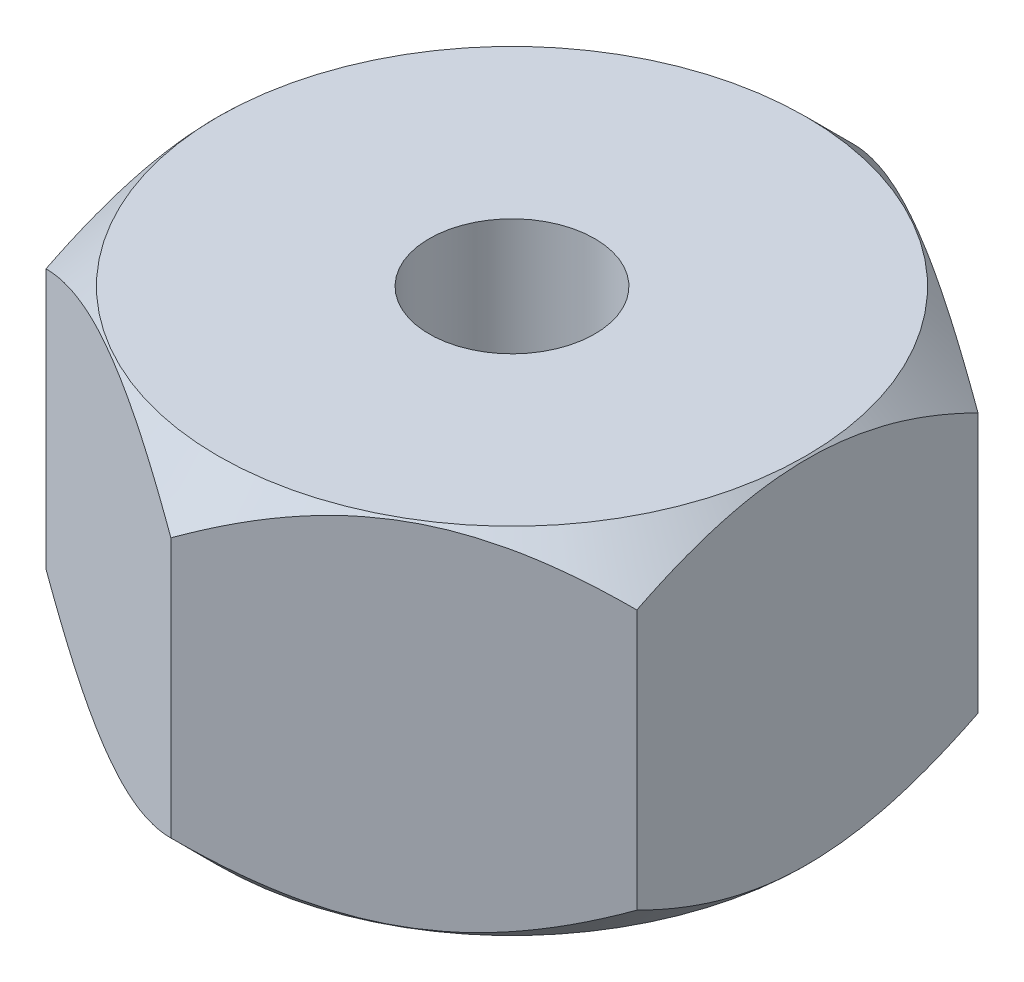
from build123d import *

# Parameters (mm, degrees)
BOSS_EXTRUDE1_DEPTH = 15
CUT_EXTRUDE2_REACH  = 26.281
SKETCH5_R           = 3.5
SKETCH8_R           = 7.75
CUT_EXTRUDE3_DEPTH  = 10


with BuildPart() as part:
    # Sketch2 → Boss-Extrude1 (new body)
    with BuildSketch(Plane(origin=(0, 0, 0), x_dir=(1, 0, 0), z_dir=(0, 1, 0))):
        Polygon((0, 14.43375673), (-12.5, 7.216878365), (-12.5, -7.216878365), (0, -14.43375673), (12.5, -7.216878365), (12.5, 7.216878365), align=None)
    extrude(amount=BOSS_EXTRUDE1_DEPTH)

    # Sketch3 → Cut-Revolve1 (revolve, cut)
    with BuildSketch(Plane(origin=(0, 0, 0), x_dir=(0, 0, -1), z_dir=(1, 0, 0))):
        Polygon((14.43375673, 15), (12.43375673, 15), (14.43375673, 13), align=None)
    cut_revolve1 = revolve(axis=Axis((0, 0, 0), (0, 1, 0)), mode=Mode.SUBTRACT)

    # Mirror1: Cut-Revolve1 across plane
    add(cut_revolve1.mirror(Plane.ZX.offset(7.5)), mode=Mode.SUBTRACT)

    # Sketch5 → Cut-Extrude2 (cut, up to next)
    with BuildSketch(Plane.XZ, mode=Mode.PRIVATE) as cut_extrude2_sk1:
        with Locations(Location((0, 0, 0), (0, 0, 270))):
            Circle(SKETCH5_R)
    cut_extrude2_tool1 = extrude(cut_extrude2_sk1.sketch, amount=-CUT_EXTRUDE2_REACH, mode=Mode.PRIVATE) & part.part
    add(cut_extrude2_tool1.solids().sort_by_distance((0, 0, 0))[0], mode=Mode.SUBTRACT)

    # Sketch8 → Cut-Extrude3 (cut)
    with BuildSketch(Plane.XZ):
        with Locations(Location((0, 0, 0), (0, 0, 270))):
            Circle(SKETCH8_R)
    extrude(amount=-CUT_EXTRUDE3_DEPTH, mode=Mode.SUBTRACT)


solid = part.part
